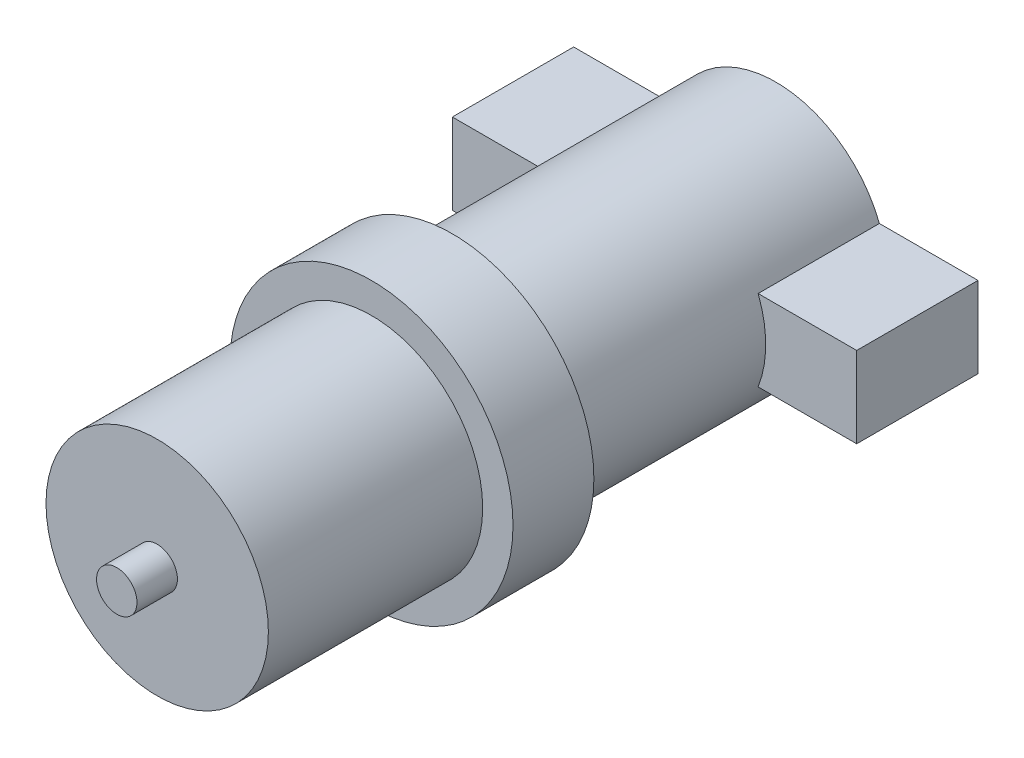
from build123d import *

# Parameters (mm, degrees)
SKETCH1_R           = 27.5
BOSS_EXTRUDE1_DEPTH = 30
SKETCH2_R           = 35
BOSS_EXTRUDE2_DEPTH = 20
SKETCH3_R           = 27.5
BOSS_EXTRUDE3_DEPTH = 53
SKETCH4_R           = 5
BOSS_EXTRUDE4_DEPTH = 10
BOSS_EXTRUDE5_START = 50
SKETCH5_R           = 27.5
BOSS_EXTRUDE5_DEPTH = 50
SKETCH8_W           = 100
SKETCH8_H           = 20
BOSS_EXTRUDE6_DEPTH = 30


with BuildPart() as part:
    # Sketch1 → Boss-Extrude1 (new body)
    with BuildSketch(Plane.XY):
        Circle(SKETCH1_R)
    extrude(amount=BOSS_EXTRUDE1_DEPTH)

    # Sketch2 → Boss-Extrude2 (add)
    with BuildSketch(Plane.XY.offset(30)):
        Circle(SKETCH2_R)
    extrude(amount=BOSS_EXTRUDE2_DEPTH)

    # Sketch3 → Boss-Extrude3 (add)
    with BuildSketch(Plane.XY.offset(50)):
        Circle(SKETCH3_R)
    extrude(amount=BOSS_EXTRUDE3_DEPTH)

    # Sketch4 → Boss-Extrude4 (add)
    with BuildSketch(Plane.XY.offset(103)):
        Circle(SKETCH4_R)
    extrude(amount=BOSS_EXTRUDE4_DEPTH)

    # Sketch5 → Boss-Extrude5 (add)
    with BuildSketch(Plane(origin=(0, 0, 0), x_dir=(-1, 0, 0), z_dir=(0, 0, -1)).offset(BOSS_EXTRUDE5_START)):
        Circle(SKETCH5_R)
    extrude(amount=-BOSS_EXTRUDE5_DEPTH)

    # Sketch8 → Boss-Extrude6 (add)
    with BuildSketch(Plane(origin=(0, 0, -50), x_dir=(-1, 0, 0), z_dir=(0, 0, -1))):
        Rectangle(SKETCH8_W, SKETCH8_H)
    extrude(amount=-BOSS_EXTRUDE6_DEPTH)


solid = part.part
